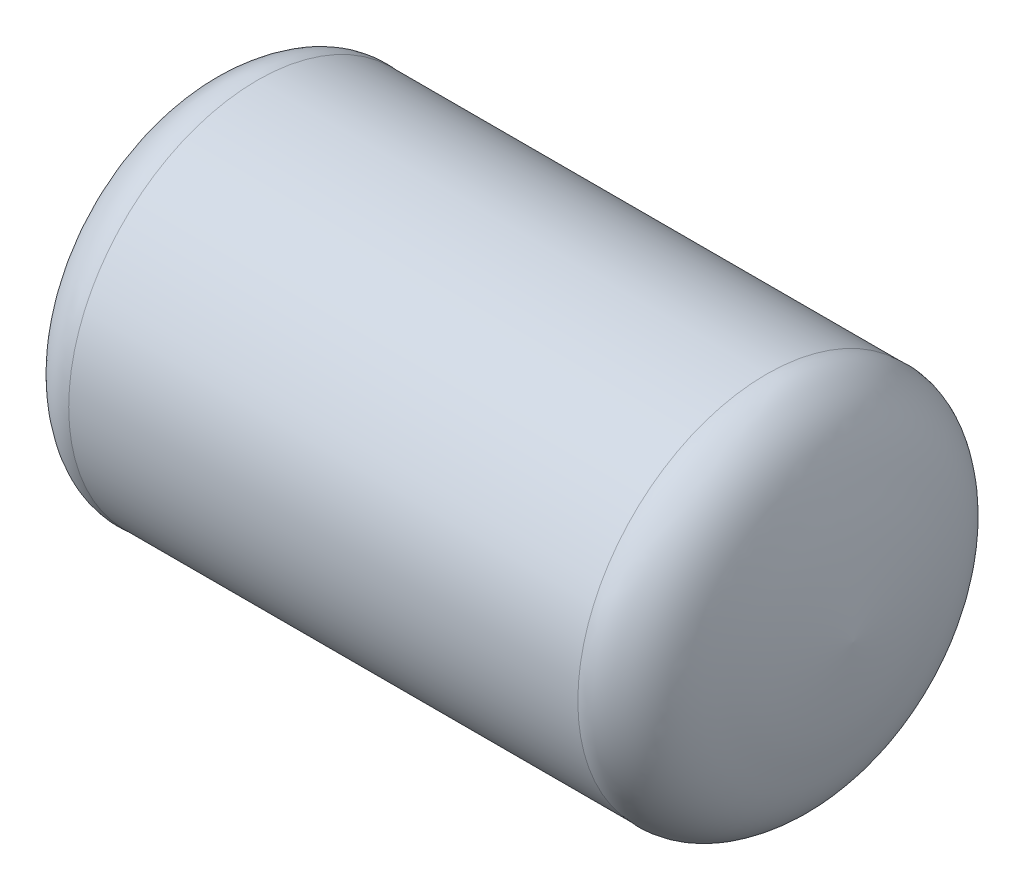
from build123d import *


with BuildPart() as part:
    # 草图1 → 旋转1 (revolve)
    with BuildSketch(Plane.XY, mode=Mode.PRIVATE) as revolve_1_sk:
        with BuildLine():
            Line((-96.309667957, 71.422926027), (96.309667957, 71.422926027))
            add(Edge.make_bspline(
                [(129.08732806, 0), (128.353786475, 9.781381495), (126.328681606, 27.187400482), (120.327737662, 49.648453022), (115.950444214, 64.645995459), (100.906558405, 72.151618226), (96.309667957, 71.422926027)],
                knots=[0, 0, 0, 0, 0.382349677, 0.474547953, 0.872267784, 1, 1, 1, 1], degree=3))
            Line((129.08732806, 0), (-129.08732806, 0))
            add(Edge.make_bspline(
                [(-129.08732806, 0), (-128.353786475, 9.781381495), (-126.328681606, 27.187400482), (-120.327737662, 49.648453022), (-115.950444214, 64.645995459), (-100.906558405, 72.151618226), (-96.309667957, 71.422926027)],
                knots=[0, 0, 0, 0, 0.382349677, 0.474547953, 0.872267784, 1, 1, 1, 1], degree=3))
        make_face()
    revolve(revolve_1_sk.sketch.rotate(Axis((-129.08732806, 0, 0), (1, 0, 0)), 90), axis=Axis((-129.08732806, 0, 0), (1, 0, 0)))

    # 草图4 → 切除-旋转1 (revolve, cut)
    with BuildSketch(Plane.XY, mode=Mode.PRIVATE) as cut_revolve_1_sk:
        with BuildLine():
            Line((-126.078801352, 0), (126.078801352, 0))
            add(Edge.make_bspline(
                [(126.078801352, 0), (125.825291509, 3.339830773), (125.508847194, 6.670679111), (124.774667492, 13.317918839), (124.355801062, 16.634148798), (123.391264797, 23.248510474), (122.847403047, 26.546900253), (121.877744354, 31.472524112), (121.527589344, 33.110554323), (120.752619912, 36.375958846), (120.330818985, 37.999151424), (119.678852055, 40.427432304), (119.459251144, 41.236167478), (119.016554178, 42.852576697), (118.792543707, 43.659973124), (118.101578535, 46.076414097), (117.616105801, 47.679836549), (116.8005799, 50.058460756), (116.514089784, 50.846888298), (115.902061747, 52.411888429), (115.575686438, 53.19024501), (114.528463327, 55.487843451), (113.740916631, 56.966941223), (112.376611407, 59.077852338), (111.891378846, 59.763553104), (110.852675062, 61.094777997), (110.30293854, 61.735013415), (108.577598885, 63.560034984), (107.319260445, 64.656708088), (105.280496447, 66.133818146), (104.572544395, 66.602749718), (103.104629812, 67.425210728), (102.343993862, 67.780062018), (101.142489185, 68.184378854), (100.731416814, 68.297303439), (99.907944952, 68.468370463), (99.49306313, 68.527449698), (98.656754583, 68.590571071), (98.235116332, 68.594604418), (97.598347527, 68.559020417), (97.386883628, 68.540325939), (96.965464459, 68.489927036), (96.755746125, 68.456179351), (96.545970464, 68.422926027)],
                knots=[0, 0, 0, 0, 0.125, 0.125, 0.25, 0.25, 0.375, 0.375, 0.4375, 0.4375, 0.5, 0.5, 0.53125, 0.53125, 0.5625, 0.5625, 0.625, 0.625, 0.65625, 0.65625, 0.6875, 0.6875, 0.75, 0.75, 0.78125, 0.78125, 0.8125, 0.8125, 0.875, 0.875, 0.90625, 0.90625, 0.9375, 0.9375, 0.953125, 0.953125, 0.96875, 0.96875, 0.984375, 0.984375, 0.9921875, 0.9921875, 1, 1, 1, 1], degree=3))
            Line((96.545970464, 68.422926027), (-96.545970464, 68.422926027))
            add(Edge.make_bspline(
                [(-96.545970464, 68.422926027), (-96.75672493, 68.45633451), (-96.967478614, 68.490210966), (-97.389015118, 68.540537375), (-97.599794404, 68.559100869), (-98.232166291, 68.594440369), (-98.653792995, 68.590819433), (-99.497140805, 68.527117065), (-99.921513362, 68.466410095), (-100.757413414, 68.291003009), (-101.166133269, 68.177386464), (-101.967723406, 67.905656908), (-102.360596482, 67.747551742), (-103.132976869, 67.393818046), (-103.513838932, 67.197342958), (-104.624644097, 66.570463838), (-105.327052628, 66.102207351), (-106.689961654, 65.110367206), (-107.348671058, 64.584418944), (-108.300231491, 63.747304242), (-108.611337634, 63.460238284), (-109.221050533, 62.869604625), (-109.519923336, 62.565679061), (-110.969214004, 61.018617602), (-111.994578681, 59.68237148), (-113.358998789, 57.5503126), (-113.786052714, 56.816579039), (-114.584652245, 55.320015093), (-114.953648693, 54.562568491), (-115.987832153, 52.268210014), (-116.58077689, 50.709449918), (-117.654215242, 47.557921148), (-118.134498327, 45.965088804), (-118.81910205, 43.565006978), (-119.041232791, 42.763143802), (-119.480480869, 41.157901247), (-119.698526032, 40.35480247), (-120.345438769, 37.943321764), (-120.763598961, 36.331701602), (-121.532443652, 33.088054616), (-121.881276065, 31.455467664), (-122.526812372, 28.17452854), (-122.823815225, 26.527075407), (-123.377766808, 23.22988543), (-123.634859773, 21.578763226), (-124.357762796, 16.619247782), (-124.776225844, 13.30483648), (-125.509597954, 6.662851605), (-125.825626286, 3.335420298), (-126.078801352, 0)],
                knots=[0, 0, 0, 0, 0.0078125, 0.0078125, 0.015625, 0.015625, 0.03125, 0.03125, 0.046875, 0.046875, 0.0625, 0.0625, 0.078125, 0.078125, 0.09375, 0.09375, 0.125, 0.125, 0.15625, 0.15625, 0.171875, 0.171875, 0.1875, 0.1875, 0.25, 0.25, 0.28125, 0.28125, 0.3125, 0.3125, 0.375, 0.375, 0.4375, 0.4375, 0.46875, 0.46875, 0.5, 0.5, 0.5625, 0.5625, 0.625, 0.625, 0.6875, 0.6875, 0.75, 0.75, 0.875, 0.875, 1, 1, 1, 1], degree=3))
        make_face()
    revolve(cut_revolve_1_sk.sketch.rotate(Axis((-126.078801352, 0, 0), (1, 0, 0)), 180), axis=Axis((-126.078801352, 0, 0), (1, 0, 0)), mode=Mode.SUBTRACT)


solid = part.part
